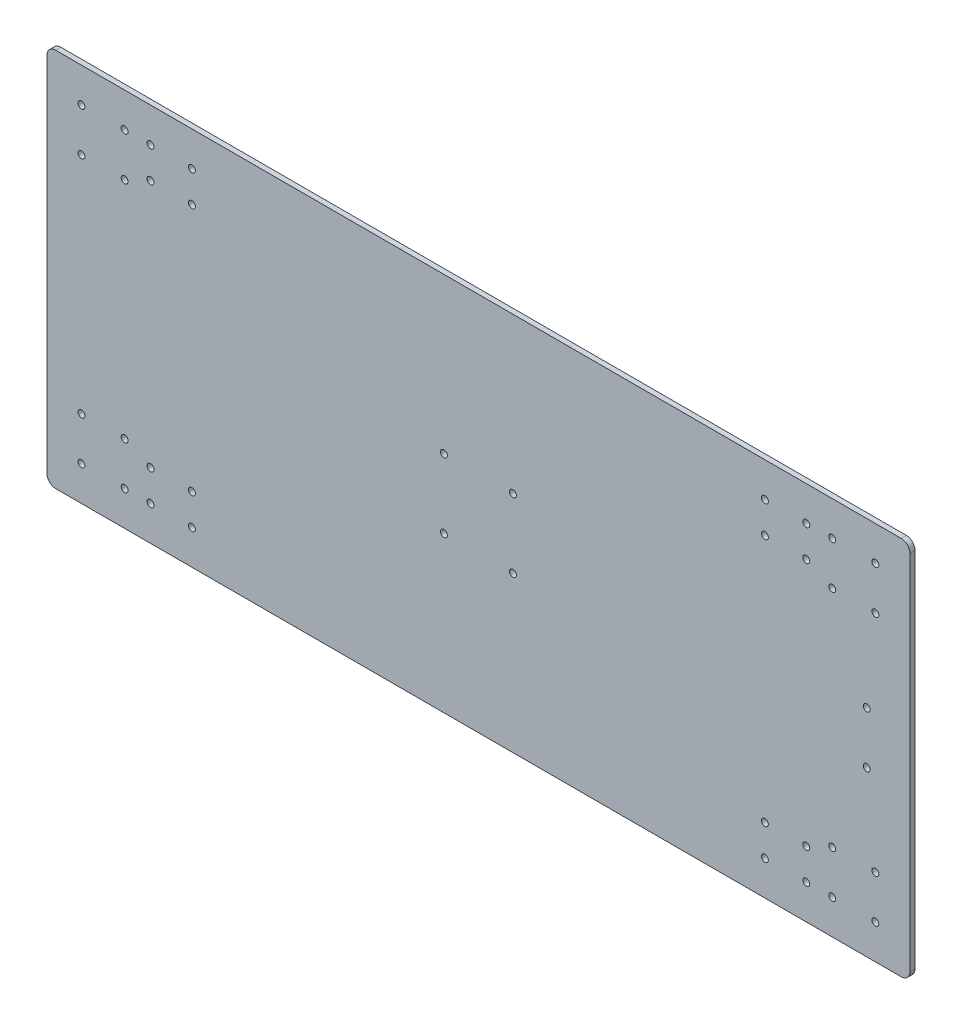
from build123d import *

# Parameters (mm, degrees)
SZKIC1_W                    = 500
SZKIC1_H                    = 220
DODANIE_WYCI_GNI_CIE1_DEPTH = 3
WYTNIJ_WYCI_GNI_CIE2_REACH  = 275.146
SZKIC5_R                    = 2
WYTNIJ_WYCI_GNI_CIE4_REACH  = 275.146
SZKIC7_R                    = 2
ZAOKR_GLENIE1_R             = 5
WYTNIJ_WYCI_GNI_CIE5_REACH  = 275.146
SZKIC8_R                    = 2
LUSTRO2_COPY_1_REACH        = 275.146
LUSTRO2_COPY_1_SKETCH_R     = 2
WYTNIJ_WYCI_GNI_CIE6_REACH  = 275.146
SZKIC9_R                    = 2
LUSTRO4_COPY_1_REACH        = 275.146
LUSTRO4_COPY_1_SKETCH_R     = 2


with BuildPart() as part:
    # Szkic1 → Dodanie-wyciągnięcie1 (new body)
    with BuildSketch(Plane.XY):
        Rectangle(SZKIC1_W, SZKIC1_H)
    extrude(amount=DODANIE_WYCI_GNI_CIE1_DEPTH)

    # Szkic5 → Wytnij-wyciągnięcie2 (cut, up to next)
    with BuildSketch(Plane.XY.offset(3), mode=Mode.PRIVATE) as wytnij_wyci_gni_cie2_sk1:
        with Locations((225, 15)):
            Circle(SZKIC5_R)
    wytnij_wyci_gni_cie2_tool1 = extrude(wytnij_wyci_gni_cie2_sk1.sketch, amount=-WYTNIJ_WYCI_GNI_CIE2_REACH, mode=Mode.PRIVATE) & part.part
    # Szkic5 → Wytnij-wyciągnięcie2 (cut, up to next)
    with BuildSketch(Plane.XY.offset(3), mode=Mode.PRIVATE) as wytnij_wyci_gni_cie2_sk2:
        with Locations((225, -15)):
            Circle(SZKIC5_R)
    wytnij_wyci_gni_cie2_tool2 = extrude(wytnij_wyci_gni_cie2_sk2.sketch, amount=-WYTNIJ_WYCI_GNI_CIE2_REACH, mode=Mode.PRIVATE) & part.part
    add(wytnij_wyci_gni_cie2_tool1.solids().sort_by_distance((225, 15, 3))[0], mode=Mode.SUBTRACT)
    add(wytnij_wyci_gni_cie2_tool2.solids().sort_by_distance((225, -15, 3))[0], mode=Mode.SUBTRACT)

    # Szkic7 → Wytnij-wyciągnięcie4 (cut, up to next)
    with BuildSketch(Plane.XY.offset(3), mode=Mode.PRIVATE) as wytnij_wyci_gni_cie4_sk1:
        with Locations((-20, 20)):
            Circle(SZKIC7_R)
    wytnij_wyci_gni_cie4_tool1 = extrude(wytnij_wyci_gni_cie4_sk1.sketch, amount=-WYTNIJ_WYCI_GNI_CIE4_REACH, mode=Mode.PRIVATE) & part.part
    # Szkic7 → Wytnij-wyciągnięcie4 (cut, up to next)
    with BuildSketch(Plane.XY.offset(3), mode=Mode.PRIVATE) as wytnij_wyci_gni_cie4_sk2:
        with Locations((20, 20)):
            Circle(SZKIC7_R)
    wytnij_wyci_gni_cie4_tool2 = extrude(wytnij_wyci_gni_cie4_sk2.sketch, amount=-WYTNIJ_WYCI_GNI_CIE4_REACH, mode=Mode.PRIVATE) & part.part
    # Szkic7 → Wytnij-wyciągnięcie4 (cut, up to next)
    with BuildSketch(Plane.XY.offset(3), mode=Mode.PRIVATE) as wytnij_wyci_gni_cie4_sk3:
        with Locations((20, -20)):
            Circle(SZKIC7_R)
    wytnij_wyci_gni_cie4_tool3 = extrude(wytnij_wyci_gni_cie4_sk3.sketch, amount=-WYTNIJ_WYCI_GNI_CIE4_REACH, mode=Mode.PRIVATE) & part.part
    # Szkic7 → Wytnij-wyciągnięcie4 (cut, up to next)
    with BuildSketch(Plane.XY.offset(3), mode=Mode.PRIVATE) as wytnij_wyci_gni_cie4_sk4:
        with Locations((-20, -20)):
            Circle(SZKIC7_R)
    wytnij_wyci_gni_cie4_tool4 = extrude(wytnij_wyci_gni_cie4_sk4.sketch, amount=-WYTNIJ_WYCI_GNI_CIE4_REACH, mode=Mode.PRIVATE) & part.part
    add(wytnij_wyci_gni_cie4_tool1.solids().sort_by_distance((-20, 20, 3))[0], mode=Mode.SUBTRACT)
    add(wytnij_wyci_gni_cie4_tool2.solids().sort_by_distance((20, 20, 3))[0], mode=Mode.SUBTRACT)
    add(wytnij_wyci_gni_cie4_tool3.solids().sort_by_distance((20, -20, 3))[0], mode=Mode.SUBTRACT)
    add(wytnij_wyci_gni_cie4_tool4.solids().sort_by_distance((-20, -20, 3))[0], mode=Mode.SUBTRACT)

    # Zaokrąglenie1
    zaokr_glenie1_edges = [part.edges().sort_by_distance(p)[0] for p in [
        (250, -110, 1.5),
        (-250, -110, 1.5),
        (-250, 110, 1.5),
        (250, 110, 1.5),
    ]]
    fillet(zaokr_glenie1_edges, radius=ZAOKR_GLENIE1_R)

    # Szkic8 → Wytnij-wyciągnięcie5 (cut, up to next)
    with BuildSketch(Plane(origin=(0, 0, 0), x_dir=(-1, 0, 0), z_dir=(0, 0, -1)), mode=Mode.PRIVATE) as wytnij_wyci_gni_cie5_sk1:
        with Locations((-230, -65)):
            Circle(SZKIC8_R)
    wytnij_wyci_gni_cie5_tool1 = extrude(wytnij_wyci_gni_cie5_sk1.sketch, amount=-WYTNIJ_WYCI_GNI_CIE5_REACH, mode=Mode.PRIVATE) & part.part
    # Szkic8 → Wytnij-wyciągnięcie5 (cut, up to next)
    with BuildSketch(Plane(origin=(0, 0, 0), x_dir=(-1, 0, 0), z_dir=(0, 0, -1)), mode=Mode.PRIVATE) as wytnij_wyci_gni_cie5_sk2:
        with Locations((-205, -65)):
            Circle(SZKIC8_R)
    wytnij_wyci_gni_cie5_tool2 = extrude(wytnij_wyci_gni_cie5_sk2.sketch, amount=-WYTNIJ_WYCI_GNI_CIE5_REACH, mode=Mode.PRIVATE) & part.part
    # Szkic8 → Wytnij-wyciągnięcie5 (cut, up to next)
    with BuildSketch(Plane(origin=(0, 0, 0), x_dir=(-1, 0, 0), z_dir=(0, 0, -1)), mode=Mode.PRIVATE) as wytnij_wyci_gni_cie5_sk3:
        with Locations((-205, -90)):
            Circle(SZKIC8_R)
    wytnij_wyci_gni_cie5_tool3 = extrude(wytnij_wyci_gni_cie5_sk3.sketch, amount=-WYTNIJ_WYCI_GNI_CIE5_REACH, mode=Mode.PRIVATE) & part.part
    # Szkic8 → Wytnij-wyciągnięcie5 (cut, up to next)
    with BuildSketch(Plane(origin=(0, 0, 0), x_dir=(-1, 0, 0), z_dir=(0, 0, -1)), mode=Mode.PRIVATE) as wytnij_wyci_gni_cie5_sk4:
        with Locations((-230, -90)):
            Circle(SZKIC8_R)
    wytnij_wyci_gni_cie5_tool4 = extrude(wytnij_wyci_gni_cie5_sk4.sketch, amount=-WYTNIJ_WYCI_GNI_CIE5_REACH, mode=Mode.PRIVATE) & part.part
    wytnij_wyci_gni_cie5_1 = wytnij_wyci_gni_cie5_tool1.solids().sort_by_distance((230, -65, 0))[0]
    add(wytnij_wyci_gni_cie5_1, mode=Mode.SUBTRACT)
    wytnij_wyci_gni_cie5_2 = wytnij_wyci_gni_cie5_tool2.solids().sort_by_distance((205, -65, 0))[0]
    add(wytnij_wyci_gni_cie5_2, mode=Mode.SUBTRACT)
    wytnij_wyci_gni_cie5_3 = wytnij_wyci_gni_cie5_tool3.solids().sort_by_distance((205, -90, 0))[0]
    add(wytnij_wyci_gni_cie5_3, mode=Mode.SUBTRACT)
    wytnij_wyci_gni_cie5_4 = wytnij_wyci_gni_cie5_tool4.solids().sort_by_distance((230, -90, 0))[0]
    add(wytnij_wyci_gni_cie5_4, mode=Mode.SUBTRACT)
    wytnij_wyci_gni_cie5 = wytnij_wyci_gni_cie5_1 + wytnij_wyci_gni_cie5_2 + wytnij_wyci_gni_cie5_3 + wytnij_wyci_gni_cie5_4  # Wytnij-wyciągnięcie5 as one shape, for the pattern or mirror that repeats it

    # Lustro1: Wytnij-wyciągnięcie5 across plane
    add(wytnij_wyci_gni_cie5.mirror(Plane(origin=(0, 0, 0), x_dir=(0, 0, 1), z_dir=(1, 0, 0))), mode=Mode.SUBTRACT)

    # Lustro2: Wytnij-wyciągnięcie5 across plane
    add(wytnij_wyci_gni_cie5.mirror(Plane.ZX), mode=Mode.SUBTRACT)

    # Lustro2 copy 1 sketch → Lustro2 copy 1 (cut, up to next)
    with BuildSketch(Plane(origin=(0, 0, 0), x_dir=(1, 0, 0), z_dir=(0, 0, -1)), mode=Mode.PRIVATE) as lustro2_copy_1_sk1:
        with Locations((-230, -65)):
            Circle(LUSTRO2_COPY_1_SKETCH_R)
    lustro2_copy_1_tool1 = extrude(lustro2_copy_1_sk1.sketch, amount=-LUSTRO2_COPY_1_REACH, mode=Mode.PRIVATE) & part.part
    # Lustro2 copy 1 sketch → Lustro2 copy 1 (cut, up to next)
    with BuildSketch(Plane(origin=(0, 0, 0), x_dir=(1, 0, 0), z_dir=(0, 0, -1)), mode=Mode.PRIVATE) as lustro2_copy_1_sk2:
        with Locations((-205, -65)):
            Circle(LUSTRO2_COPY_1_SKETCH_R)
    lustro2_copy_1_tool2 = extrude(lustro2_copy_1_sk2.sketch, amount=-LUSTRO2_COPY_1_REACH, mode=Mode.PRIVATE) & part.part
    # Lustro2 copy 1 sketch → Lustro2 copy 1 (cut, up to next)
    with BuildSketch(Plane(origin=(0, 0, 0), x_dir=(1, 0, 0), z_dir=(0, 0, -1)), mode=Mode.PRIVATE) as lustro2_copy_1_sk3:
        with Locations((-205, -90)):
            Circle(LUSTRO2_COPY_1_SKETCH_R)
    lustro2_copy_1_tool3 = extrude(lustro2_copy_1_sk3.sketch, amount=-LUSTRO2_COPY_1_REACH, mode=Mode.PRIVATE) & part.part
    # Lustro2 copy 1 sketch → Lustro2 copy 1 (cut, up to next)
    with BuildSketch(Plane(origin=(0, 0, 0), x_dir=(1, 0, 0), z_dir=(0, 0, -1)), mode=Mode.PRIVATE) as lustro2_copy_1_sk4:
        with Locations((-230, -90)):
            Circle(LUSTRO2_COPY_1_SKETCH_R)
    lustro2_copy_1_tool4 = extrude(lustro2_copy_1_sk4.sketch, amount=-LUSTRO2_COPY_1_REACH, mode=Mode.PRIVATE) & part.part
    add(lustro2_copy_1_tool1.solids().sort_by_distance((-230, 65, 0))[0], mode=Mode.SUBTRACT)
    add(lustro2_copy_1_tool2.solids().sort_by_distance((-205, 65, 0))[0], mode=Mode.SUBTRACT)
    add(lustro2_copy_1_tool3.solids().sort_by_distance((-205, 90, 0))[0], mode=Mode.SUBTRACT)
    add(lustro2_copy_1_tool4.solids().sort_by_distance((-230, 90, 0))[0], mode=Mode.SUBTRACT)

    # Szkic9 → Wytnij-wyciągnięcie6 (cut, up to next)
    with BuildSketch(Plane(origin=(0, 0, 0), x_dir=(-1, 0, 0), z_dir=(0, 0, -1)), mode=Mode.PRIVATE) as wytnij_wyci_gni_cie6_sk1:
        with Locations((-190, -72)):
            Circle(SZKIC9_R)
    wytnij_wyci_gni_cie6_tool1 = extrude(wytnij_wyci_gni_cie6_sk1.sketch, amount=-WYTNIJ_WYCI_GNI_CIE6_REACH, mode=Mode.PRIVATE) & part.part
    # Szkic9 → Wytnij-wyciągnięcie6 (cut, up to next)
    with BuildSketch(Plane(origin=(0, 0, 0), x_dir=(-1, 0, 0), z_dir=(0, 0, -1)), mode=Mode.PRIVATE) as wytnij_wyci_gni_cie6_sk2:
        with Locations((-166, -72)):
            Circle(SZKIC9_R)
    wytnij_wyci_gni_cie6_tool2 = extrude(wytnij_wyci_gni_cie6_sk2.sketch, amount=-WYTNIJ_WYCI_GNI_CIE6_REACH, mode=Mode.PRIVATE) & part.part
    # Szkic9 → Wytnij-wyciągnięcie6 (cut, up to next)
    with BuildSketch(Plane(origin=(0, 0, 0), x_dir=(-1, 0, 0), z_dir=(0, 0, -1)), mode=Mode.PRIVATE) as wytnij_wyci_gni_cie6_sk3:
        with Locations((-166, -90)):
            Circle(SZKIC9_R)
    wytnij_wyci_gni_cie6_tool3 = extrude(wytnij_wyci_gni_cie6_sk3.sketch, amount=-WYTNIJ_WYCI_GNI_CIE6_REACH, mode=Mode.PRIVATE) & part.part
    # Szkic9 → Wytnij-wyciągnięcie6 (cut, up to next)
    with BuildSketch(Plane(origin=(0, 0, 0), x_dir=(-1, 0, 0), z_dir=(0, 0, -1)), mode=Mode.PRIVATE) as wytnij_wyci_gni_cie6_sk4:
        with Locations((-190, -90)):
            Circle(SZKIC9_R)
    wytnij_wyci_gni_cie6_tool4 = extrude(wytnij_wyci_gni_cie6_sk4.sketch, amount=-WYTNIJ_WYCI_GNI_CIE6_REACH, mode=Mode.PRIVATE) & part.part
    wytnij_wyci_gni_cie6_1 = wytnij_wyci_gni_cie6_tool1.solids().sort_by_distance((190, -72, 0))[0]
    add(wytnij_wyci_gni_cie6_1, mode=Mode.SUBTRACT)
    wytnij_wyci_gni_cie6_2 = wytnij_wyci_gni_cie6_tool2.solids().sort_by_distance((166, -72, 0))[0]
    add(wytnij_wyci_gni_cie6_2, mode=Mode.SUBTRACT)
    wytnij_wyci_gni_cie6_3 = wytnij_wyci_gni_cie6_tool3.solids().sort_by_distance((166, -90, 0))[0]
    add(wytnij_wyci_gni_cie6_3, mode=Mode.SUBTRACT)
    wytnij_wyci_gni_cie6_4 = wytnij_wyci_gni_cie6_tool4.solids().sort_by_distance((190, -90, 0))[0]
    add(wytnij_wyci_gni_cie6_4, mode=Mode.SUBTRACT)
    wytnij_wyci_gni_cie6 = wytnij_wyci_gni_cie6_1 + wytnij_wyci_gni_cie6_2 + wytnij_wyci_gni_cie6_3 + wytnij_wyci_gni_cie6_4  # Wytnij-wyciągnięcie6 as one shape, for the pattern or mirror that repeats it

    # Lustro3: Wytnij-wyciągnięcie6 across plane
    add(wytnij_wyci_gni_cie6.mirror(Plane.ZX), mode=Mode.SUBTRACT)

    # Lustro4: Wytnij-wyciągnięcie6 across plane
    add(wytnij_wyci_gni_cie6.mirror(Plane(origin=(0, 0, 0), x_dir=(0, 0, 1), z_dir=(1, 0, 0))), mode=Mode.SUBTRACT)

    # Lustro4 copy 1 sketch → Lustro4 copy 1 (cut, up to next)
    with BuildSketch(Plane(origin=(0, 0, 0), x_dir=(1, 0, 0), z_dir=(0, 0, -1)), mode=Mode.PRIVATE) as lustro4_copy_1_sk1:
        with Locations((-190, -72)):
            Circle(LUSTRO4_COPY_1_SKETCH_R)
    lustro4_copy_1_tool1 = extrude(lustro4_copy_1_sk1.sketch, amount=-LUSTRO4_COPY_1_REACH, mode=Mode.PRIVATE) & part.part
    # Lustro4 copy 1 sketch → Lustro4 copy 1 (cut, up to next)
    with BuildSketch(Plane(origin=(0, 0, 0), x_dir=(1, 0, 0), z_dir=(0, 0, -1)), mode=Mode.PRIVATE) as lustro4_copy_1_sk2:
        with Locations((-166, -72)):
            Circle(LUSTRO4_COPY_1_SKETCH_R)
    lustro4_copy_1_tool2 = extrude(lustro4_copy_1_sk2.sketch, amount=-LUSTRO4_COPY_1_REACH, mode=Mode.PRIVATE) & part.part
    # Lustro4 copy 1 sketch → Lustro4 copy 1 (cut, up to next)
    with BuildSketch(Plane(origin=(0, 0, 0), x_dir=(1, 0, 0), z_dir=(0, 0, -1)), mode=Mode.PRIVATE) as lustro4_copy_1_sk3:
        with Locations((-166, -90)):
            Circle(LUSTRO4_COPY_1_SKETCH_R)
    lustro4_copy_1_tool3 = extrude(lustro4_copy_1_sk3.sketch, amount=-LUSTRO4_COPY_1_REACH, mode=Mode.PRIVATE) & part.part
    # Lustro4 copy 1 sketch → Lustro4 copy 1 (cut, up to next)
    with BuildSketch(Plane(origin=(0, 0, 0), x_dir=(1, 0, 0), z_dir=(0, 0, -1)), mode=Mode.PRIVATE) as lustro4_copy_1_sk4:
        with Locations((-190, -90)):
            Circle(LUSTRO4_COPY_1_SKETCH_R)
    lustro4_copy_1_tool4 = extrude(lustro4_copy_1_sk4.sketch, amount=-LUSTRO4_COPY_1_REACH, mode=Mode.PRIVATE) & part.part
    add(lustro4_copy_1_tool1.solids().sort_by_distance((-190, 72, 0))[0], mode=Mode.SUBTRACT)
    add(lustro4_copy_1_tool2.solids().sort_by_distance((-166, 72, 0))[0], mode=Mode.SUBTRACT)
    add(lustro4_copy_1_tool3.solids().sort_by_distance((-166, 90, 0))[0], mode=Mode.SUBTRACT)
    add(lustro4_copy_1_tool4.solids().sort_by_distance((-190, 90, 0))[0], mode=Mode.SUBTRACT)


solid = part.part
